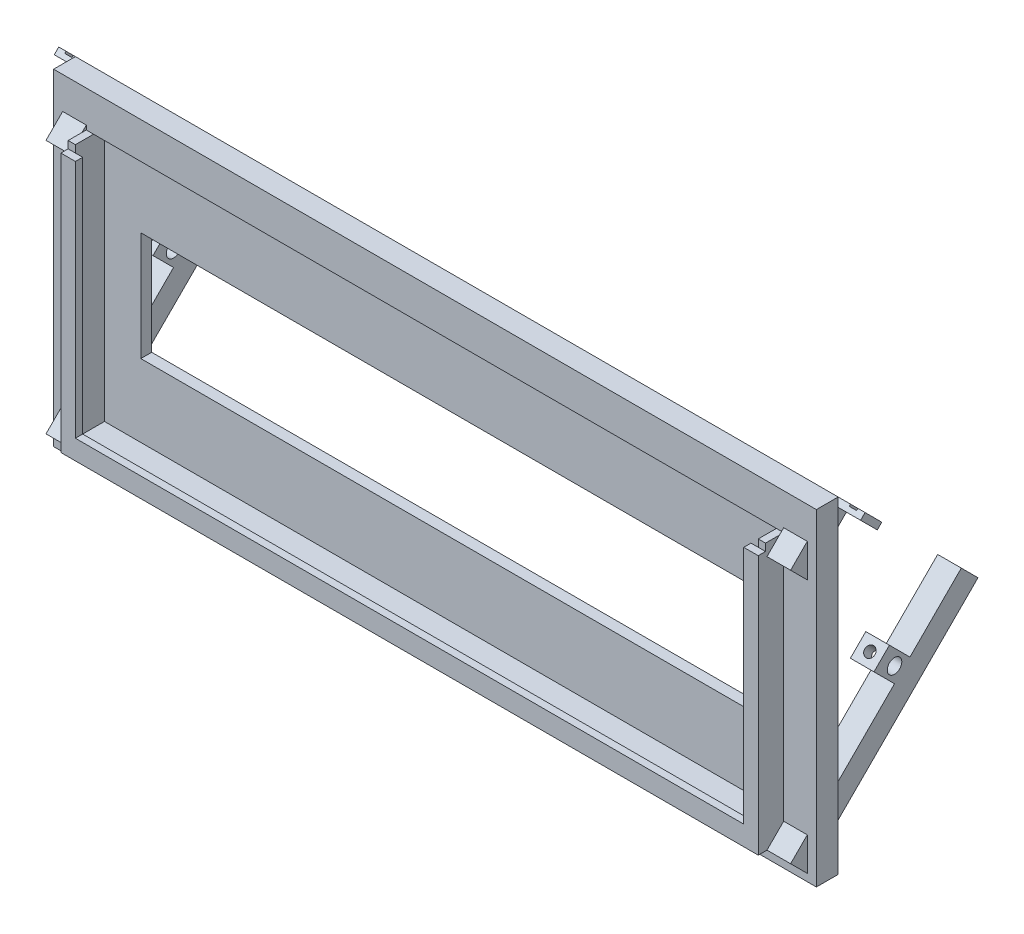
from build123d import *

# Parameters (mm, degrees)
SKETCH2_W                       = 210
SKETCH2_H                       = 90
BOSS_EXTRUDE1_DEPTH             = 6
SKETCH3_W                       = 188
SKETCH3_H                       = 70
CUT_EXTRUDE1_DEPTH              = 3
CUT_EXTRUDE2_REACH              = 116.276
SKETCH4_W                       = 168
SKETCH4_H                       = 30
BOSS_EXTRUDE2_DEPTH             = 9
CUT_EXTRUDE3_DEPTH              = 2.5
SKETCH9_R                       = 3
CUT_EXTRUDE5_DEPTH              = 7
CUT_EXTRUDE7_DEPTH              = 2.5
CUT_EXTRUDE9_REACH              = 125.918
SKETCH14_R                      = 1.5
SKETCH15_R                      = 3
CUT_EXTRUDE10_DEPTH             = 7
CUT_EXTRUDE12_REACH             = 139.325
SKETCH17_R                      = 1.5
BOSS_EXTRUDE3_DEPTH             = 9
SKETCH19_R                      = 3
CUT_EXTRUDE13_DEPTH             = 7
SKETCH20_R                      = 3
CUT_EXTRUDE14_DEPTH             = 7
CUT_EXTRUDE15_DEPTH             = 2.5
CUT_EXTRUDE16_REACH             = 125.918
SKETCH22_R                      = 1.5
CUT_EXTRUDE16_DIRECTION_2_DEPTH = 124.918371619
CUT_EXTRUDE17_REACH             = 139.325
SKETCH23_R                      = 1.5
CUT_EXTRUDE18_DEPTH             = 2.5
SKETCH25_W                      = 6.5
SKETCH25_H                      = 6
BOSS_EXTRUDE4_DEPTH             = 8
SKETCH26_R                      = 1.4
CUT_EXTRUDE19_DEPTH             = 4
SKETCH27_R                      = 2
CUT_EXTRUDE20_DEPTH             = 217.245809208
BOSS_EXTRUDE6_DEPTH             = 8.5
CUT_EXTRUDE21_REACH             = 145.328
SKETCH29_W                      = 2
SKETCH29_H                      = 0.5
BOSS_EXTRUDE7_DEPTH             = 8.5
CUT_EXTRUDE22_REACH             = 145.328
SKETCH31_W                      = 2
SKETCH31_H                      = 0.5
BOSS_EXTRUDE8_DEPTH             = 5
BOSS_EXTRUDE9_DEPTH             = 2


with BuildPart() as part:
    # Sketch2 → Boss-Extrude1 (new body)
    with BuildSketch(Plane.XY):
        Rectangle(SKETCH2_W, SKETCH2_H)
    extrude(amount=BOSS_EXTRUDE1_DEPTH)

    # Sketch3 → Cut-Extrude1 (cut)
    with BuildSketch(Plane.XY.offset(6)):
        Rectangle(SKETCH3_W, SKETCH3_H)
    extrude(amount=-CUT_EXTRUDE1_DEPTH, mode=Mode.SUBTRACT)

    # Sketch4 → Cut-Extrude2 (cut, up to next)
    with BuildSketch(Plane.XY.offset(3), mode=Mode.PRIVATE) as cut_extrude2_sk1:
        Rectangle(SKETCH4_W, SKETCH4_H)
    cut_extrude2_tool1 = extrude(cut_extrude2_sk1.sketch, amount=-CUT_EXTRUDE2_REACH, mode=Mode.PRIVATE) & part.part
    add(cut_extrude2_tool1.solids().sort_by_distance((0, 0, 3))[0], mode=Mode.SUBTRACT)

    # Sketch7 → Boss-Extrude2 (add)
    with BuildSketch(Plane.ZY.offset(105)):
        Polygon((-6.01040764, 38.98959236), (-1.414213562, 43.585786438), (10.596194078, 31.575378798), (6, 26.97918472), align=None)
        Polygon((-41, 4), (6, -43), (10.596194078, -38.403805922), (-36.403805922, 8.596194078), align=None)
    extrude(amount=-BOSS_EXTRUDE2_DEPTH)

    # Sketch8 → Cut-Extrude3 (cut)
    with BuildSketch(Plane.ZY.offset(105)):
        Polygon((6, 36.171572875), (10.596194078, 31.575378798), (6, 26.97918472), align=None)
        Polygon((6, -33.807611845), (6, -43), (10.596194078, -38.403805922), align=None)
    extrude(amount=-CUT_EXTRUDE3_DEPTH, mode=Mode.SUBTRACT)

    # Sketch9 → Cut-Extrude5 (cut)
    with BuildSketch(Plane(origin=(0, 10.48959236, -10.48959236), x_dir=(1, 0, 0), z_dir=(0, -0.7071067811865437, 0.7071067811865515))):
        with Locations(Location((-99.25, 26.569805153, 0), (0, 0, 270))):
            Circle(SKETCH9_R)
    extrude(amount=-CUT_EXTRUDE5_DEPTH, mode=Mode.SUBTRACT)

    # Sketch11 → Cut-Extrude7 (cut)
    with BuildSketch(Plane.ZY.offset(105)):
        Polygon((-1.414213562, 43.585786438), (0, 42.171572875), (0, 32.97918472), (-6.01040764, 38.98959236), align=None)
        Polygon((-36.403805922, 8.596194078), (-41, 4), (0, -37), (0, -27.807611845), align=None)
    extrude(amount=-CUT_EXTRUDE7_DEPTH, mode=Mode.SUBTRACT)

    # Sketch14 → Cut-Extrude9 (cut, up to next)
    with BuildSketch(Plane(origin=(0, 15.439339828, -15.439339828), x_dir=(1, 0, 0), z_dir=(0, -0.7071067811865437, 0.7071067811865515)), mode=Mode.PRIVATE) as cut_extrude9_sk1:
        with Locations(Location((-99.25, 26.569805153, 0), (0, 0, 270))):
            Circle(SKETCH14_R)
    cut_extrude9_tool1 = extrude(cut_extrude9_sk1.sketch, amount=-CUT_EXTRUDE9_REACH, mode=Mode.PRIVATE) & part.part
    add(cut_extrude9_tool1.solids().sort_by_distance((-99.25, 34.227029, 3.34835))[0], mode=Mode.SUBTRACT)

    # Sketch15 → Cut-Extrude10 (cut)
    with BuildSketch(Plane(origin=(0, -24.5, 24.5), x_dir=(1, 0, 0), z_dir=(0, -0.707106781186551, 0.7071067811865441))):
        with Locations(Location((-99.25, -22.912950904, 0), (0, 0, 270))):
            Circle(SKETCH15_R)
    extrude(amount=-CUT_EXTRUDE10_DEPTH, mode=Mode.SUBTRACT)

    # Sketch17 → Cut-Extrude12 (cut, up to next)
    with BuildSketch(Plane(origin=(0, -19.550252532, 19.550252532), x_dir=(1, 0, 0), z_dir=(0, -0.7071067811865509, 0.7071067811865442)), mode=Mode.PRIVATE) as cut_extrude12_sk1:
        with Locations(Location((-99.25, -22.912950904, 0), (0, 0, 270))):
            Circle(SKETCH17_R)
    cut_extrude12_tool1 = extrude(cut_extrude12_sk1.sketch, amount=-CUT_EXTRUDE12_REACH, mode=Mode.PRIVATE) & part.part
    add(cut_extrude12_tool1.solids().sort_by_distance((-99.25, -35.752155, 3.34835))[0], mode=Mode.SUBTRACT)

    # Sketch18 → Boss-Extrude3 (add)
    with BuildSketch(Plane(origin=(105, 0, 0), x_dir=(0, 0, -1), z_dir=(1, 0, 0))):
        Polygon((-10.596194078, 31.575378798), (1.414213562, 43.585786438), (6.01040764, 38.98959236), (-6, 26.97918472), align=None)
        Polygon((-10.596194078, -38.403805922), (36.403805922, 8.596194078), (41, 4), (-6, -43), align=None)
    extrude(amount=-BOSS_EXTRUDE3_DEPTH)

    # Sketch19 → Cut-Extrude13 (cut)
    with BuildSketch(Plane(origin=(0, 10.48959236, -10.48959236), x_dir=(1, 0, 0), z_dir=(0, -0.7071067811865444, 0.7071067811865508))):
        with Locations(Location((99.25, 26.569805153, 0), (0, 0, 270))):
            Circle(SKETCH19_R)
    extrude(amount=-CUT_EXTRUDE13_DEPTH, mode=Mode.SUBTRACT)

    # Sketch20 → Cut-Extrude14 (cut)
    with BuildSketch(Plane(origin=(0, -24.5, 24.5), x_dir=(1, 0, 0), z_dir=(0, -0.707106781186551, 0.7071067811865441))):
        with Locations(Location((99.25, -22.912950904, 0), (0, 0, 270))):
            Circle(SKETCH20_R)
    extrude(amount=-CUT_EXTRUDE14_DEPTH, mode=Mode.SUBTRACT)

    # Sketch21 → Cut-Extrude15 (cut)
    with BuildSketch(Plane(origin=(105, 0, 0), x_dir=(0, 0, -1), z_dir=(1, 0, 0))):
        Polygon((-10.596194078, -38.403805922), (-6, -33.807611845), (-6, -43), align=None)
        Polygon((-6, 36.171572875), (-6, 26.97918472), (-10.596194078, 31.575378798), align=None)
    extrude(amount=-CUT_EXTRUDE15_DEPTH, mode=Mode.SUBTRACT)

    # Sketch22 → Cut-Extrude16 (cut, up to next)
    with BuildSketch(Plane(origin=(0, 15.439339828, -15.439339828), x_dir=(1, 0, 0), z_dir=(0, -0.7071067811865445, 0.7071067811865507)), mode=Mode.PRIVATE) as cut_extrude16_sk1:
        with Locations(Location((99.25, 26.569805153, 0), (0, 0, 90))):
            Circle(SKETCH22_R)
    cut_extrude16_tool1 = extrude(cut_extrude16_sk1.sketch, amount=-CUT_EXTRUDE16_REACH, mode=Mode.PRIVATE) & part.part
    add(cut_extrude16_tool1.solids().sort_by_distance((99.25, 34.227029, 3.34835))[0], mode=Mode.SUBTRACT)

    # Sketch22 → Cut-Extrude16 direction 2 (cut)
    with BuildSketch(Plane(origin=(0, 15.439339828, -15.439339828), x_dir=(1, 0, 0), z_dir=(0, -0.7071067811865445, 0.7071067811865507))):
        with Locations(Location((99.25, 26.569805153, 0), (0, 0, 90))):
            Circle(SKETCH22_R)
    extrude(amount=CUT_EXTRUDE16_DIRECTION_2_DEPTH, mode=Mode.SUBTRACT)

    # Sketch23 → Cut-Extrude17 (cut, up to next)
    with BuildSketch(Plane(origin=(0, -19.550252532, 19.550252532), x_dir=(1, 0, 0), z_dir=(0, -0.7071067811865509, 0.7071067811865442)), mode=Mode.PRIVATE) as cut_extrude17_sk1:
        with Locations(Location((99.25, -22.912950904, 0), (0, 0, 270))):
            Circle(SKETCH23_R)
    cut_extrude17_tool1 = extrude(cut_extrude17_sk1.sketch, amount=-CUT_EXTRUDE17_REACH, mode=Mode.PRIVATE) & part.part
    add(cut_extrude17_tool1.solids().sort_by_distance((99.25, -35.752155, 3.34835))[0], mode=Mode.SUBTRACT)

    # Sketch24 → Cut-Extrude18 (cut)
    with BuildSketch(Plane(origin=(105, 0, 0), x_dir=(0, 0, -1), z_dir=(1, 0, 0))):
        Polygon((1.414213562, 43.585786438), (0, 42.171572875), (0, 32.97918472), (6.01040764, 38.98959236), align=None)
        Polygon((0, -27.807611845), (0, -37), (41, 4), (36.403805922, 8.596194078), align=None)
    extrude(amount=-CUT_EXTRUDE18_DEPTH, mode=Mode.SUBTRACT)

    # Sketch25 → Boss-Extrude4 (add)
    with BuildSketch(Plane(origin=(0, -13.903805922, -13.903805922), x_dir=(1, 0, 0), z_dir=(0, 0.7071067811865439, 0.7071067811865511))):
        with Locations((-99.25, 8.819805153)):
            Rectangle(SKETCH25_W, SKETCH25_H)
        with Locations((99.25, 8.819805153)):
            Rectangle(SKETCH25_W, SKETCH25_H)
    extrude(amount=BOSS_EXTRUDE4_DEPTH)

    # Sketch26 → Cut-Extrude19 (cut)
    with BuildSketch(Plane(origin=(0, -8.246951673, -8.246951673), x_dir=(1, 0, 0), z_dir=(0, 0.7071067811865438, 0.7071067811865512))):
        with Locations(Location((99.25, 8.819805153, 0), (0, 0, 270))):
            Circle(SKETCH26_R)
        with Locations(Location((-99.25, 8.819805153, 0), (0, 0, 270))):
            Circle(SKETCH26_R)
    extrude(amount=-CUT_EXTRUDE19_DEPTH, mode=Mode.SUBTRACT)

    # Sketch27 → Cut-Extrude20 (cut, through all)
    with BuildSketch(Plane.ZY.offset(102.5)):
        with Locations((-18.019029611, -5.545941546)):
            Circle(SKETCH27_R)
    extrude(amount=-CUT_EXTRUDE20_DEPTH, mode=Mode.SUBTRACT)

    # Sketch28 → Boss-Extrude6 (add)
    with BuildSketch(Plane(origin=(102.5, 0, 0), x_dir=(0, 0, -1), z_dir=(1, 0, 0))):
        Polygon((1.414213562, 43.585786438), (6.01040764, 38.98959236), (4.772970773, 37.752155493), (0.176776695, 42.348349571), align=None)
    extrude(amount=BOSS_EXTRUDE6_DEPTH)

    # Sketch29 → Cut-Extrude21 (cut, up to next)
    with BuildSketch(Plane(origin=(0, 21.085786438, 21.085786438), x_dir=(1, 0, 0), z_dir=(0, 0.7071067811865506, 0.7071067811865446)), mode=Mode.PRIVATE) as cut_extrude21_sk1:
        with Locations((108, 31.569805153)):
            Rectangle(SKETCH29_W, SKETCH29_H)
    cut_extrude21_tool1 = extrude(cut_extrude21_sk1.sketch, amount=-CUT_EXTRUDE21_REACH, mode=Mode.PRIVATE) & part.part
    add(cut_extrude21_tool1.solids().sort_by_distance((108, 43.40901, -1.237437))[0], mode=Mode.SUBTRACT)

    # Sketch30 → Boss-Extrude7 (add)
    with BuildSketch(Plane.ZY.offset(102.5)):
        Polygon((-1.414213562, 43.585786438), (-6.01040764, 38.98959236), (-4.772970773, 37.752155493), (-0.176776695, 42.348349571), align=None)
    extrude(amount=BOSS_EXTRUDE7_DEPTH)

    # Sketch31 → Cut-Extrude22 (cut, up to next)
    with BuildSketch(Plane(origin=(0, 21.085786438, 21.085786438), x_dir=(1, 0, 0), z_dir=(0, 0.7071067811865506, 0.7071067811865446)), mode=Mode.PRIVATE) as cut_extrude22_sk1:
        with Locations((-108, 31.569805153)):
            Rectangle(SKETCH31_W, SKETCH31_H)
    cut_extrude22_tool1 = extrude(cut_extrude22_sk1.sketch, amount=-CUT_EXTRUDE22_REACH, mode=Mode.PRIVATE) & part.part
    add(cut_extrude22_tool1.solids().sort_by_distance((-108, 43.40901, -1.237437))[0], mode=Mode.SUBTRACT)

    # Sketch32 → Boss-Extrude8 (add)
    with BuildSketch(Plane.XY.offset(6)):
        Polygon((-96, -38.403805922), (96, -38.403805922), (96, 35), (94, 35), (94, -35), (-94, -35), (-94, 35), (-96, 35), align=None)
    extrude(amount=BOSS_EXTRUDE8_DEPTH)

    # Sketch33 → Boss-Extrude9 (add)
    with BuildSketch(Plane.XY.offset(11)):
        Polygon((-96, -38.403805922), (96, -38.403805922), (96, 33), (92, 33), (92, -33), (-92, -33), (-92, 33), (-96, 33), align=None)
    extrude(amount=BOSS_EXTRUDE9_DEPTH)


solid = part.part
